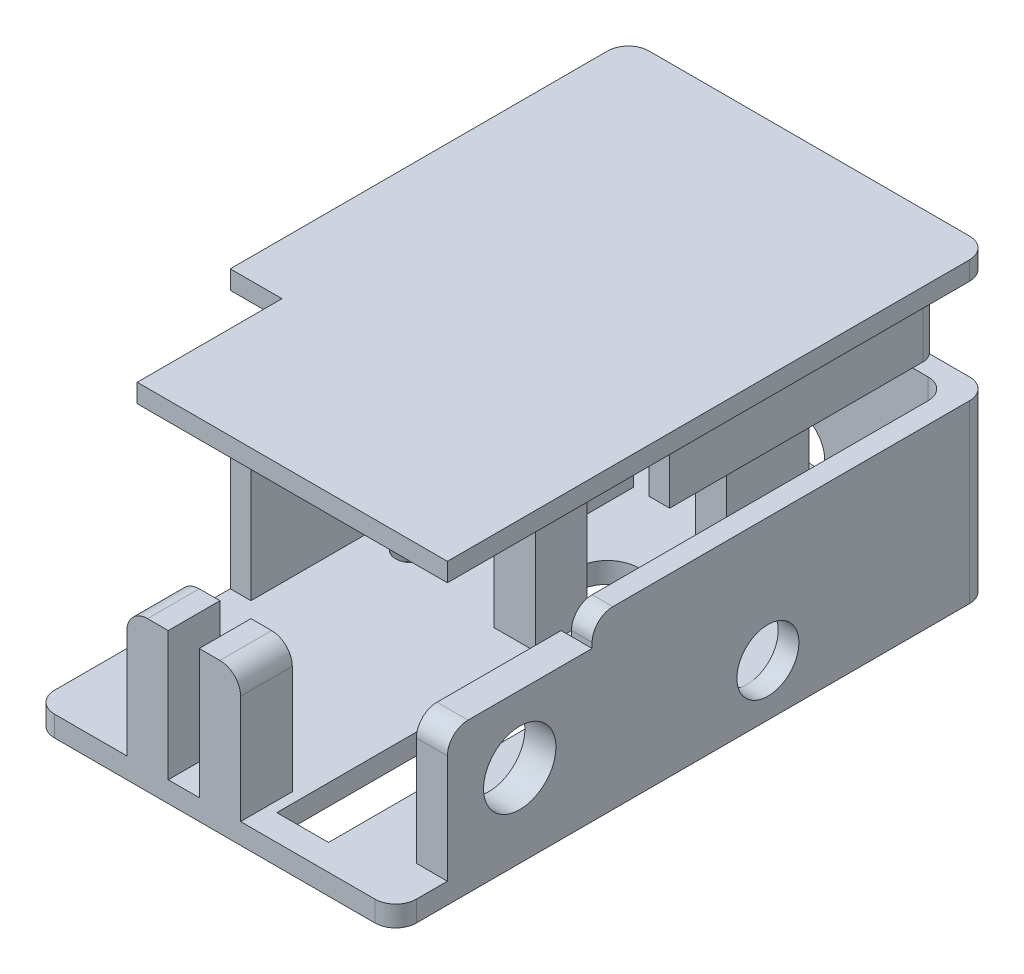
from build123d import *

# Parameters (mm, degrees)
SKETCH2_W                      = 3
SKETCH2_H                      = 14
BOSS_EXTRUDE2_DEPTH            = 12.5
SKETCH2_W_2                    = 4
SKETCH2_H_2                    = 5
BOSS_EXTRUDE2_2_DEPTH          = 12.5
BOSS_EXTRUDE2_3_DEPTH          = 12.5
BOSS_EXTRUDE2_4_DEPTH          = 12.5
SKETCH3_W                      = 35
SKETCH3_H                      = 57.5
BOSS_EXTRUDE3_DEPTH            = 2
CUT_EXTRUDE1_DEPTH             = 41.031237802
CUT_EXTRUDE1_DEPTH_BACK        = 41.031237802
SKETCH4_R                      = 3.5
SKETCH5_R                      = 0.6
BOSS_EXTRUDE4_DEPTH            = 1.5
SKETCH6_W                      = 3
SKETCH6_H                      = 8
BOSS_EXTRUDE5_DEPTH            = 12.5
SKETCH14_W                     = 1
SKETCH14_H                     = 8
BOSS_EXTRUDE7_DEPTH            = 2
BOSS_EXTRUDE8_DEPTH            = 15
CUT_EXTRUDE3_REACH             = 64.091
SKETCH10_R                     = 3
CUT_EXTRUDE4_DEPTH             = 41.880924647
CUT_EXTRUDE4_DEPTH_BACK        = 41.880924647
SKETCH12_R                     = 1.5
CUT_EXTRUDE5_DEPTH             = 41.880924647
CUT_EXTRUDE5_DEPTH_BACK        = 41.880924647
SKETCH15_W                     = 5
SKETCH15_H                     = 28.5
CUT_EXTRUDE7_REACH             = 64.091
SKETCH17_W                     = 10
SKETCH17_H                     = 5
FILLET1_R                      = 2
CUT_EXTRUDE8_REACH             = 52.717
SKETCH18_R                     = 3
CUT_EXTRUDE8_DIRECTION_2_DEPTH = 51.717354032
CUT_EXTRUDE9_REACH             = 64.091
SKETCH19_R                     = 3
BOSS_EXTRUDE10_DEPTH           = 7
BOSS_EXTRUDE10_2_DEPTH         = 7
BOSS_EXTRUDE9_DEPTH            = 1.8


with BuildPart() as part:
    # Sketch2 → Boss-Extrude2 (new body)
    with BuildSketch(Plane(origin=(0, 0, 0), x_dir=(1, 0, 0), z_dir=(0, 1, 0))):
        with Locations((15.5, -21.5)):
            Rectangle(SKETCH2_W, SKETCH2_H)
    extrude(amount=BOSS_EXTRUDE2_DEPTH)



with BuildPart() as body_2:
    # Sketch2 → Boss-Extrude2 2 (new body)
    with BuildSketch(Plane(origin=(0, 0, 0), x_dir=(1, 0, 0), z_dir=(0, 1, 0))):
        with Locations((0, -31)):
            Rectangle(SKETCH2_W_2, SKETCH2_H_2)
    extrude(amount=BOSS_EXTRUDE2_2_DEPTH)


with BuildPart() as body_3:
    # Sketch2 → Boss-Extrude2 3 (new body)
    with BuildSketch(Plane(origin=(0, 0, 0), x_dir=(1, 0, 0), z_dir=(0, 1, 0))):
        with Locations((0, -2.5)):
            Rectangle(SKETCH2_W_2, SKETCH2_H_2)
    extrude(amount=BOSS_EXTRUDE2_3_DEPTH)


with BuildPart() as body_4:
    # Sketch2 → Boss-Extrude2 4 (new body)
    with BuildSketch(Plane(origin=(0, 0, 0), x_dir=(1, 0, 0), z_dir=(0, 1, 0))):
        with Locations((-7, -31)):
            Rectangle(SKETCH2_W_2, SKETCH2_H_2)
    extrude(amount=BOSS_EXTRUDE2_4_DEPTH)


with BuildPart() as part_1:
    add(part.part)

    add(body_2.part)  # Boss-Extrude3 merges body 2

    add(body_3.part)  # Boss-Extrude3 merges body 3

    add(body_4.part)  # Boss-Extrude3 merges body 4
    # Sketch3 → Boss-Extrude3 (add)
    with BuildSketch(Plane.XZ):
        with Locations((-0.5, 4.75)):
            Rectangle(SKETCH3_W, SKETCH3_H)
    extrude(amount=BOSS_EXTRUDE3_DEPTH)

    # Sketch4 → Cut-Extrude1 (cut, two sides: drawn at the far end of the back side and taken through both)
    with BuildSketch(Plane(origin=(0, 0, 0), x_dir=(0, 0, -1), z_dir=(1, 0, 0)).offset(-CUT_EXTRUDE1_DEPTH_BACK)):
        with Locations((-21.5, 6)):
            Circle(SKETCH4_R)
    extrude(amount=CUT_EXTRUDE1_DEPTH + CUT_EXTRUDE1_DEPTH_BACK, mode=Mode.SUBTRACT)

    # Sketch5 → Boss-Extrude4 (add)
    with BuildSketch(Plane.ZY.offset(2)):
        with Locations(Location((2.5, 6.5, 0), (0, 0, 180))):
            Circle(SKETCH5_R)
    extrude(amount=BOSS_EXTRUDE4_DEPTH)

    # Sketch6 → Boss-Extrude5 (add)
    with BuildSketch(Plane(origin=(0, 0, 0), x_dir=(1, 0, 0), z_dir=(0, 1, 0))):
        with Locations((-8.5, 9.5)):
            Rectangle(SKETCH6_W, SKETCH6_H)
        with Locations((8.5, 9.5)):
            Rectangle(SKETCH6_W, SKETCH6_H)
    extrude(amount=BOSS_EXTRUDE5_DEPTH)

    # Sketch14 → Boss-Extrude7 (add)
    with BuildSketch(Plane(origin=(0, 12.5, 0), x_dir=(1, 0, 0), z_dir=(0, 1, 0))):
        with Locations((-9.5, 9.5)):
            Rectangle(SKETCH14_W, SKETCH14_H)
        with Locations((9.5, 9.5)):
            Rectangle(SKETCH14_W, SKETCH14_H)
    extrude(amount=BOSS_EXTRUDE7_DEPTH)

    # Sketch9 → Boss-Extrude8 (add)
    with BuildSketch(Plane(origin=(0, 0, 0), x_dir=(1, 0, 0), z_dir=(0, 1, 0))):
        Polygon((-18, 24), (17, 24), (17, -14.5), (15, -14.5), (15, 22), (-16, 22), (-16, -14.5), (-18, -14.5), align=None)
    extrude(amount=BOSS_EXTRUDE8_DEPTH)

    # Sketch10 → Cut-Extrude3 (cut, up to next)
    with BuildSketch(Plane(origin=(0, 0, -24), x_dir=(-1, 0, 0), z_dir=(0, 1, 0)), mode=Mode.PRIVATE) as cut_extrude3_sk1:
        with Locations(Location((0, 20, 0), (0, 0, 90))):
            Circle(SKETCH10_R)
    cut_extrude3_tool1 = extrude(cut_extrude3_sk1.sketch, amount=-CUT_EXTRUDE3_REACH, mode=Mode.PRIVATE) & part_1.part
    add(cut_extrude3_tool1.solids().sort_by_distance((0, 0, -4))[0], mode=Mode.SUBTRACT)

    # Sketch12 → Cut-Extrude4 (cut, two sides: drawn at the far end of the back side and taken through both)
    with BuildSketch(Plane(origin=(0, 0, 0), x_dir=(1, 0, 0), z_dir=(0, 1, 0)).offset(-CUT_EXTRUDE4_DEPTH_BACK)):
        with Locations(Location((-12.5, -2.5, 0), (0, 0, 270))):
            Circle(SKETCH12_R)
        with Locations(Location((12.5, -2.5, 0), (0, 0, 90))):
            Circle(SKETCH12_R)
    extrude(amount=CUT_EXTRUDE4_DEPTH + CUT_EXTRUDE4_DEPTH_BACK, mode=Mode.SUBTRACT)

    # Sketch15 → Cut-Extrude5 (cut, two sides: drawn at the far end of the back side and taken through both)
    with BuildSketch(Plane(origin=(0, 0, 0), x_dir=(1, 0, 0), z_dir=(0, 1, 0)).offset(-CUT_EXTRUDE5_DEPTH_BACK)):
        with Locations((5.5, -16.75)):
            Rectangle(SKETCH15_W, SKETCH15_H)
    extrude(amount=CUT_EXTRUDE5_DEPTH + CUT_EXTRUDE5_DEPTH_BACK, mode=Mode.SUBTRACT)

    # Sketch17 → Cut-Extrude7 (cut, up to next)
    with BuildSketch(Plane(origin=(0, 0, -24), x_dir=(-1, 0, 0), z_dir=(0, 0, -1)), mode=Mode.PRIVATE) as cut_extrude7_sk1:
        with Locations((0, 15)):
            Rectangle(SKETCH17_W, SKETCH17_H)
    cut_extrude7_tool1 = extrude(cut_extrude7_sk1.sketch, amount=-CUT_EXTRUDE7_REACH, mode=Mode.PRIVATE) & part_1.part
    add(cut_extrude7_tool1.solids().sort_by_distance((0, 15, -24))[0], mode=Mode.SUBTRACT)

    # Fillet1
    fillet1_edges = [part_1.edges().sort_by_distance(p)[0] for p in [
        (15.5, 12.5, 28.5),
        (16, 15, 14.5),
        (5, 15, -23),
        (-5, 15, -23),
        (-17, 15, 14.5),
        (-18, -1, 33.5),
        (-18, 6.5, -24),
        (17, 6.5, -24),
        (15, 7.5, -22),
        (-16, 7.5, -22),
        (2, 12.5, 31),
        (-9, 12.5, 31),
        (17, -1, 33.5),
    ]]
    fillet(fillet1_edges, radius=FILLET1_R)

    # Sketch18 → Cut-Extrude8 (cut, up to next)
    with BuildSketch(Plane(origin=(17, 0, 0), x_dir=(0, 0, -1), z_dir=(1, 0, 0)), mode=Mode.PRIVATE) as cut_extrude8_sk1:
        with Locations(Location((2.5, 3, 0), (0, 0, 180))):
            Circle(SKETCH18_R)
    cut_extrude8_tool1 = extrude(cut_extrude8_sk1.sketch, amount=-CUT_EXTRUDE8_REACH, mode=Mode.PRIVATE) & part_1.part
    cut_extrude8 = cut_extrude8_tool1.solids().sort_by_distance((17, 3, -2.5))[0]
    add(cut_extrude8, mode=Mode.SUBTRACT)

    # Sketch18 → Cut-Extrude8 direction 2 (cut)
    with BuildSketch(Plane(origin=(17, 0, 0), x_dir=(0, 0, -1), z_dir=(1, 0, 0))):
        with Locations(Location((2.5, 3, 0), (0, 0, 180))):
            Circle(SKETCH18_R)
    cut_extrude8_direction_2 = extrude(amount=CUT_EXTRUDE8_DIRECTION_2_DEPTH, mode=Mode.SUBTRACT)

    # Mirror1: Cut-Extrude8, Cut-Extrude8 direction 2 across plane
    add(cut_extrude8.mirror(Plane(origin=(0, 0, 0), x_dir=(0, 0, 1), z_dir=(1, 0, 0))), mode=Mode.SUBTRACT)
    add(cut_extrude8_direction_2.mirror(Plane(origin=(0, 0, 0), x_dir=(0, 0, 1), z_dir=(1, 0, 0))), mode=Mode.SUBTRACT)

    # Sketch19 → Cut-Extrude9 (cut, up to next)
    with BuildSketch(Plane(origin=(0, 0, -24), x_dir=(-1, 0, 0), z_dir=(0, 0, -1)), mode=Mode.PRIVATE) as cut_extrude9_sk1:
        with Locations((0, 3)):
            Circle(SKETCH19_R)
    cut_extrude9_tool1 = extrude(cut_extrude9_sk1.sketch, amount=-CUT_EXTRUDE9_REACH, mode=Mode.PRIVATE) & part_1.part
    add(cut_extrude9_tool1.solids().sort_by_distance((0, 3, -24))[0], mode=Mode.SUBTRACT)


with BuildPart() as body_2_2:
    # Sketch22 → Boss-Extrude10 (new body)
    with BuildSketch(Plane(origin=(0, 25, 0), x_dir=(1, 0, 0), z_dir=(0, 1, 0))):
        with BuildLine():
            Line((-14, 21.5), (-13.5, 21.5))
            Line((-13.5, 21.5), (-13.5, -4.5))
            Line((-13.5, -4.5), (-15.5, -4.5))
            Line((-15.5, -4.5), (-15.5, 20))
            ThreePointArc((-15.5, 20), (-15.060660172, 21.060660172), (-14, 21.5))
        make_face()
    extrude(amount=-BOSS_EXTRUDE10_DEPTH)



with BuildPart() as body_3_2:
    # Sketch22 → Boss-Extrude10 2 (new body)
    with BuildSketch(Plane(origin=(0, 25, 0), x_dir=(1, 0, 0), z_dir=(0, 1, 0))):
        with BuildLine():
            Line((12.5, -4.5), (14.5, -4.5))
            Line((14.5, -4.5), (14.5, 20))
            ThreePointArc((14.5, 20), (14.060660172, 21.060660172), (13, 21.5))
            Line((13, 21.5), (12.5, 21.5))
            Line((12.5, 21.5), (12.5, -4.5))
        make_face()
    extrude(amount=-BOSS_EXTRUDE10_2_DEPTH)


with BuildPart() as body_2_2_1:
    add(body_2_2.part)

    add(body_3_2.part)  # Boss-Extrude9 merges body 3 2
    # Sketch21 → Boss-Extrude9 (add)
    with BuildSketch(Plane(origin=(0, 25, 0), x_dir=(1, 0, 0), z_dir=(0, 1, 0))):
        with BuildLine():
            Line((-18, -12.5), (-18, -14.5))
            Line((-18, -14.5), (-13, -14.5))
            Line((-13, -14.5), (-13, -28.5))
            Line((-13, -28.5), (17, -28.5))
            Line((17, -28.5), (17, -12.5))
            Line((17, -12.5), (17, 22))
            ThreePointArc((17, 22), (16.414213562, 23.414213562), (15, 24))
            Line((15, 24), (7, 24))
            Line((7, 24), (5, 24))
            Line((5, 24), (-5, 24))
            Line((-5, 24), (-7, 24))
            Line((-7, 24), (-16, 24))
            ThreePointArc((-16, 24), (-17.414213562, 23.414213562), (-18, 22))
            Line((-18, 22), (-18, -12.5))
        make_face()
    extrude(amount=BOSS_EXTRUDE9_DEPTH)


solid = Compound([part_1.part, body_2_2_1.part])
